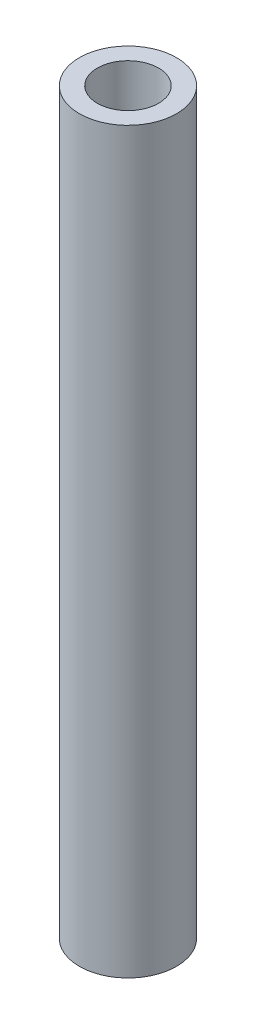
from build123d import *

# Parameters (mm, degrees)
SKETCH1_R           = 3.175
SKETCH1_R_2         = 2
BOSS_EXTRUDE1_DEPTH = 48.26


with BuildPart() as part:
    # Sketch1 → Boss-Extrude1 (new body)
    with BuildSketch(Plane(origin=(0, 0, 0), x_dir=(1, 0, 0), z_dir=(0, 1, 0))):
        with Locations(Location((0, 0, 0), (0, 0, 270))):
            Circle(SKETCH1_R)
        with Locations(Location((0, 0, 0), (0, 0, 270))):
            Circle(SKETCH1_R_2, mode=Mode.SUBTRACT)
    extrude(amount=-BOSS_EXTRUDE1_DEPTH)


solid = part.part
